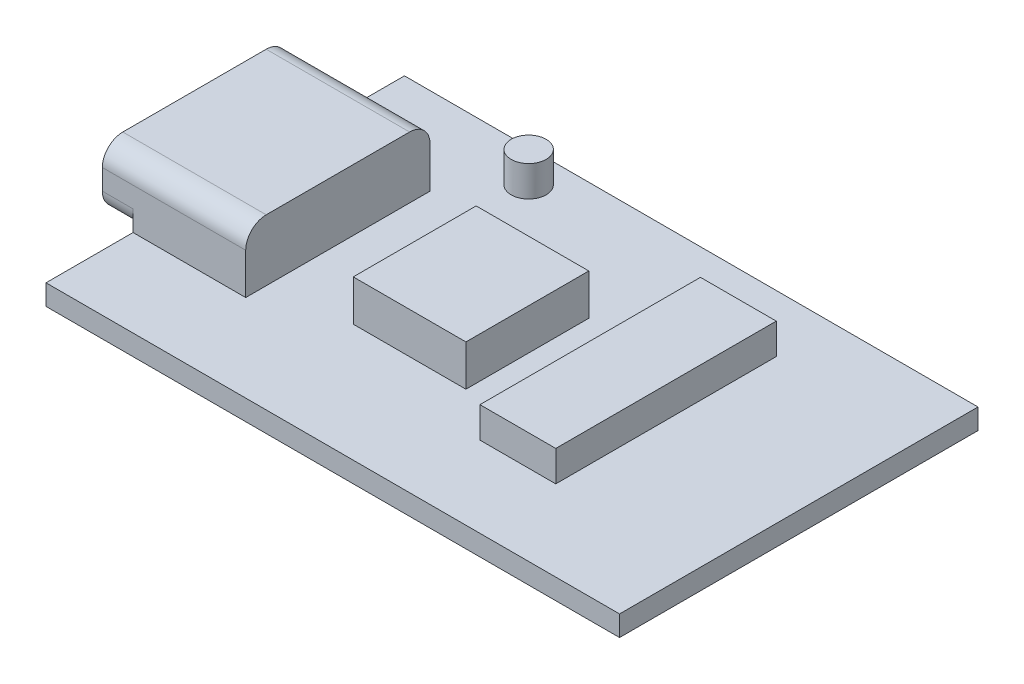
from build123d import *

# Parameters (mm, degrees)
SKETCH1_W           = 28
SKETCH1_H           = 17.5
BOSS_EXTRUDE1_DEPTH = 1
SKETCH2_W           = 7
SKETCH2_H           = 9
BOSS_EXTRUDE2_DEPTH = 3
FILLET1_R           = 1
SKETCH3_W           = 5.5
SKETCH3_H           = 6
BOSS_EXTRUDE3_DEPTH = 2
SKETCH4_R           = 0.852579897
SKETCH4_W           = 3.701013581
SKETCH4_H           = 10.765249821
BOSS_EXTRUDE5_DEPTH = 1.5


with BuildPart() as part:
    # Sketch1 → Boss-Extrude1 (new body)
    with BuildSketch(Plane(origin=(0, 0, 0), x_dir=(1, 0, 0), z_dir=(0, 1, 0))):
        Rectangle(SKETCH1_W, SKETCH1_H)
    extrude(amount=BOSS_EXTRUDE1_DEPTH)

    # Sketch2 → Boss-Extrude2 (add)
    with BuildSketch(Plane(origin=(0, 1, 0), x_dir=(1, 0, 0), z_dir=(0, 1, 0))):
        with Locations((-12, 0)):
            Rectangle(SKETCH2_W, SKETCH2_H)
    extrude(amount=BOSS_EXTRUDE2_DEPTH)

    # Fillet1
    fillet1_edges = [part.edges().sort_by_distance(p)[0] for p in [
        (-14.75, 1, 4.5),
        (-14.75, 1, -4.5),
        (-12, 4, 4.5),
        (-12, 4, -4.5),
    ]]
    fillet(fillet1_edges, radius=FILLET1_R)

    # Sketch3 → Boss-Extrude3 (add)
    with BuildSketch(Plane(origin=(0, 1, 0), x_dir=(1, 0, 0), z_dir=(0, 1, 0))):
        with Locations((-2, 0)):
            Rectangle(SKETCH3_W, SKETCH3_H)
    extrude(amount=BOSS_EXTRUDE3_DEPTH)

    # Sketch4 → Boss-Extrude5 (add)
    with BuildSketch(Plane(origin=(0, 1, 0), x_dir=(1, 0, 0), z_dir=(0, 1, 0))):
        with Locations(Location((-6.360266619, 7.174385454, 0), (0, 0, 90))):
            Circle(SKETCH4_R)
        with Locations((5.095251608, 0.572775911)):
            Rectangle(SKETCH4_W, SKETCH4_H)
    extrude(amount=BOSS_EXTRUDE5_DEPTH)


solid = part.part
